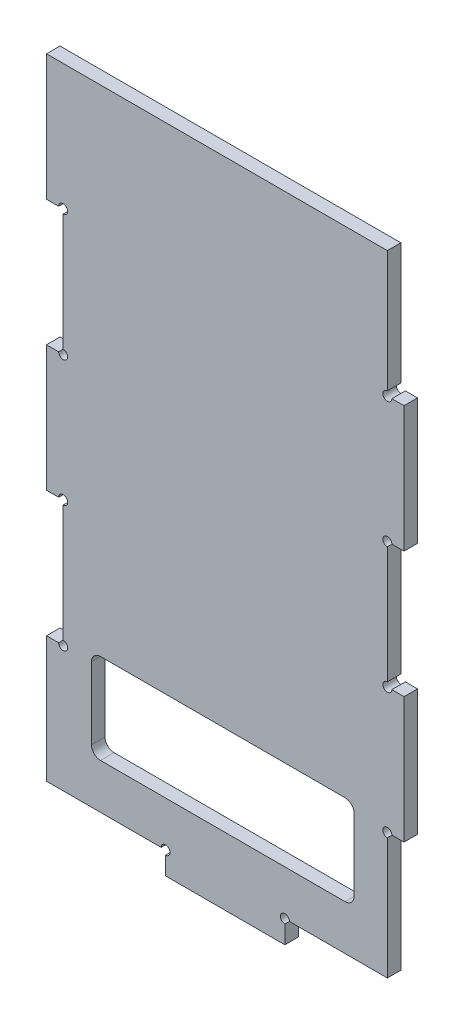
from build123d import *

# Parameters (mm, degrees)
SKETCH1_W           = 79.45
SKETCH1_H           = 140
BOSS_EXTRUDE1_DEPTH = 3
SKETCH2_W           = 58.35
SKETCH2_H           = 20
CUT_EXTRUDE1_DEPTH  = 81.542384029
FILLET1_R           = 2
SKETCH3_W           = 3.7
SKETCH3_H           = 28
CUT_EXTRUDE2_DEPTH  = 81.542384029
SKETCH5_W           = 26.5
SKETCH5_H           = 5
BOSS_EXTRUDE2_DEPTH = 3
SKETCH6_R           = 1
CUT_EXTRUDE3_DEPTH  = 85.923940235


with BuildPart() as part:
    # Sketch1 → Boss-Extrude1 (new body)
    with BuildSketch(Plane.XY):
        Rectangle(SKETCH1_W, SKETCH1_H)
    extrude(amount=BOSS_EXTRUDE1_DEPTH)

    # Sketch2 → Cut-Extrude1 (cut, through all)
    with BuildSketch(Plane.XY.offset(3)):
        with Locations((-0.55, -50)):
            Rectangle(SKETCH2_W, SKETCH2_H)
    extrude(amount=-CUT_EXTRUDE1_DEPTH, mode=Mode.SUBTRACT)

    # Fillet1
    fillet1_edges = [part.edges().sort_by_distance(p)[0] for p in [
        (28.625, -40, 1.5),
        (28.625, -60, 1.5),
        (-29.725, -60, 1.5),
        (-29.725, -40, 1.5),
    ]]
    fillet(fillet1_edges, radius=FILLET1_R)

    # Sketch3 → Cut-Extrude2 (cut, through all)
    with BuildSketch(Plane.XY.offset(3)):
        with Locations((-37.875, 28)):
            Rectangle(SKETCH3_W, SKETCH3_H)
        with Locations((-37.875, -28)):
            Rectangle(SKETCH3_W, SKETCH3_H)
        with Locations((37.875, 56)):
            Rectangle(SKETCH3_W, SKETCH3_H)
        with Locations((37.875, 0)):
            Rectangle(SKETCH3_W, SKETCH3_H)
        with Locations((37.875, -56)):
            Rectangle(SKETCH3_W, SKETCH3_H)
    extrude(amount=-CUT_EXTRUDE2_DEPTH, mode=Mode.SUBTRACT)

    # Sketch5 → Boss-Extrude2 (add)
    with BuildSketch(Plane.XY.offset(3)):
        with Locations((0, -72.5)):
            Rectangle(SKETCH5_W, SKETCH5_H)
    extrude(amount=-BOSS_EXTRUDE2_DEPTH)

    # Sketch6 → Cut-Extrude3 (cut, through all)
    with BuildSketch(Plane.XY.offset(3)):
        with Locations((-36.025, 42)):
            Circle(SKETCH6_R)
        with Locations((-36.025, 14)):
            Circle(SKETCH6_R)
        with Locations((-36.025, -14)):
            Circle(SKETCH6_R)
        with Locations((-36.025, -42)):
            Circle(SKETCH6_R)
        with Locations((-13.25, -70)):
            Circle(SKETCH6_R)
        with Locations((13.25, -70)):
            Circle(SKETCH6_R)
        with Locations((36.025, -42)):
            Circle(SKETCH6_R)
        with Locations((36.025, -14)):
            Circle(SKETCH6_R)
        with Locations((36.025, 14)):
            Circle(SKETCH6_R)
        with Locations((36.025, 42)):
            Circle(SKETCH6_R)
    extrude(amount=-CUT_EXTRUDE3_DEPTH, mode=Mode.SUBTRACT)


solid = part.part
